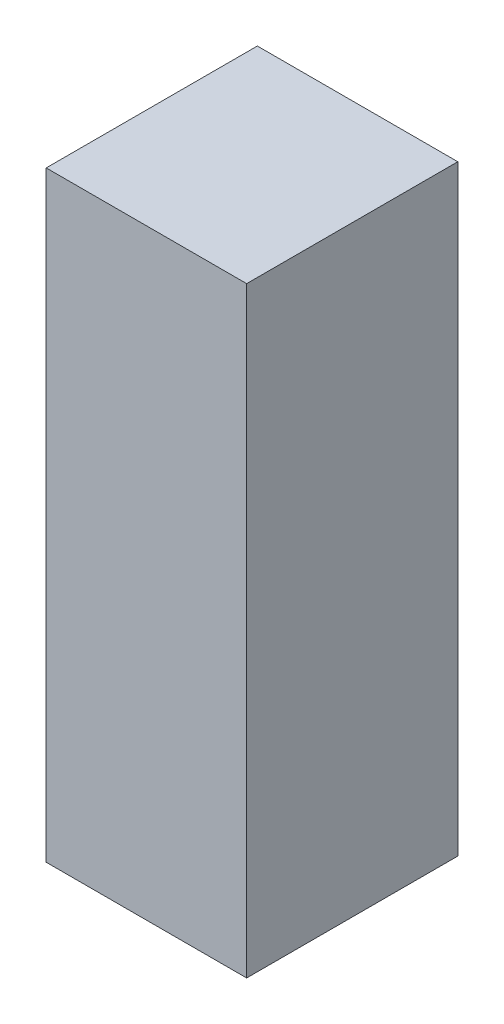
from build123d import *

# Parameters (mm, degrees)
SKETCH2_W           = 3.16
SKETCH2_H           = 9
BOSS_EXTRUDE1_DEPTH = 3


with BuildPart() as part:
    # Sketch2 → Boss-Extrude1 (new body)
    with BuildSketch(Plane(origin=(0, 0, 0), x_dir=(0, 0, -1), z_dir=(1, 0, 0))):
        with Locations((1.58, 4.5)):
            Rectangle(SKETCH2_W, SKETCH2_H)
    extrude(amount=BOSS_EXTRUDE1_DEPTH)


solid = part.part
